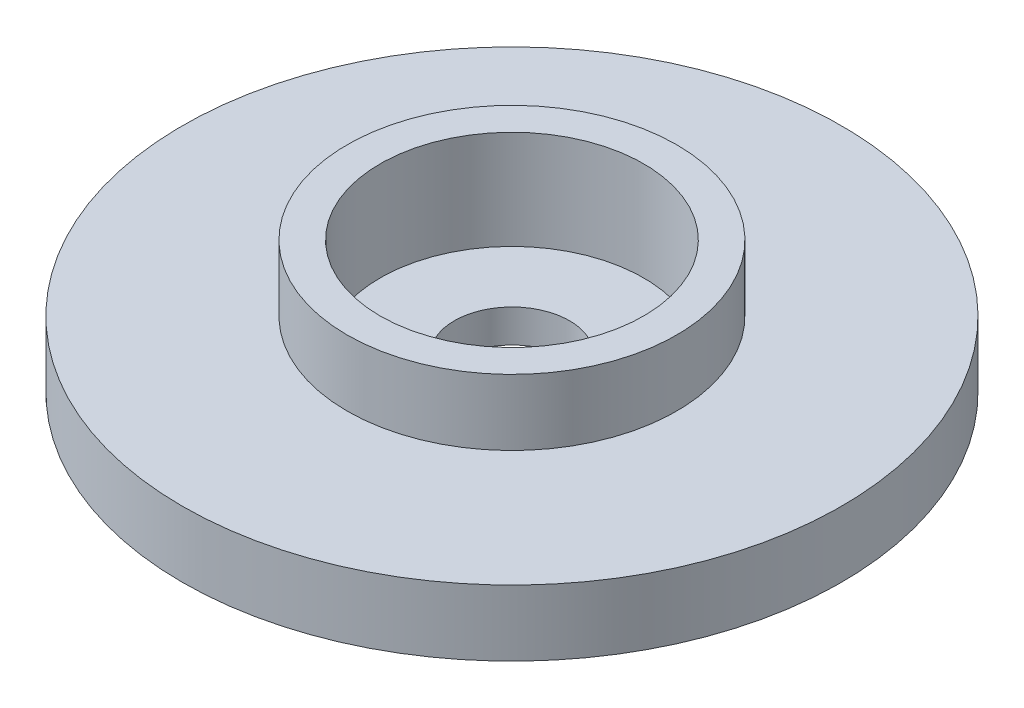
from build123d import *

# Parameters (mm, degrees)
SKETCH_1_R          = 10
EXTRUDE_1_DEPTH     = 2
SKETCH_2_R          = 5
EXTRUDE_2_DEPTH     = 2
SKETCH_3_R          = 1.75
CUT_EXTRUDE_1_DEPTH = 15.696938457
SKETCH_4_R          = 4
CUT_EXTRUDE_2_DEPTH = 3
SCALE_1_SCALE       = 0.5


with BuildPart() as part:
    # 草图1 → 凸台-拉伸1 (new body)
    with BuildSketch(Plane(origin=(0, 0, 0), x_dir=(1, 0, 0), z_dir=(0, 1, 0))):
        with Locations(Location((0, 0, 0), (0, 0, 270))):
            Circle(SKETCH_1_R)
    extrude(amount=EXTRUDE_1_DEPTH)

    # 草图2 → 凸台-拉伸2 (add)
    with BuildSketch(Plane(origin=(0, 2, 0), x_dir=(1, 0, 0), z_dir=(0, 1, 0))):
        with Locations(Location((0, 0, 0), (0, 0, 270))):
            Circle(SKETCH_2_R)
    extrude(amount=EXTRUDE_2_DEPTH)

    # 草图3 → 切除-拉伸1 (cut, through all)
    with BuildSketch(Plane(origin=(0, 4, 0), x_dir=(1, 0, 0), z_dir=(0, 1, 0))):
        with Locations(Location((0, 0, 0), (0, 0, 270))):
            Circle(SKETCH_3_R)
    extrude(amount=-CUT_EXTRUDE_1_DEPTH, mode=Mode.SUBTRACT)

    # 草图4 → 切除-拉伸2 (cut)
    with BuildSketch(Plane(origin=(0, 4, 0), x_dir=(1, 0, 0), z_dir=(0, 1, 0))):
        with Locations(Location((0, 0, 0), (0, 0, 270))):
            Circle(SKETCH_4_R)
    extrude(amount=-CUT_EXTRUDE_2_DEPTH, mode=Mode.SUBTRACT)


with BuildPart() as part_1:
    # 缩放比例1: scaled about (0, 1.148444863, 0)
    add(part.part.scale(SCALE_1_SCALE).moved(Location((0, 0.574222431, 0))))


solid = part_1.part
